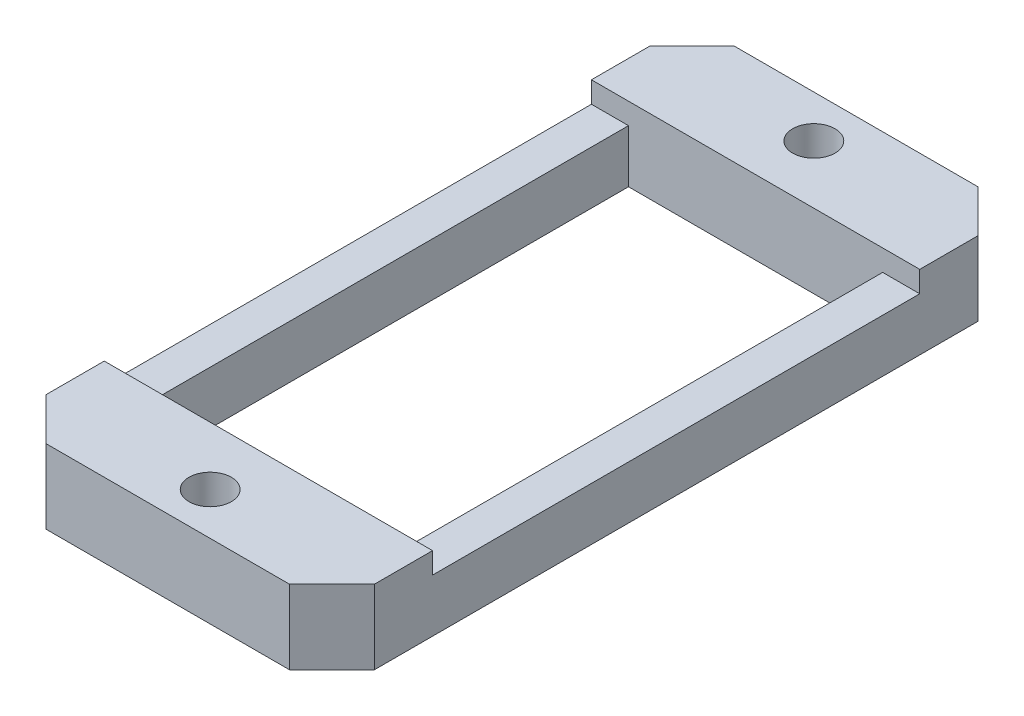
from build123d import *

# Parameters (mm, degrees)
EXTRUDE_1_DEPTH     = 7.75
SKETCH_3_R          = 1
SKETCH_3_W          = 12
SKETCH_3_H          = 23
CUT_EXTRUDE_1_DEPTH = 34.594084301
CHAMFER_1_SIZE      = 2


with BuildPart() as part:
    # 草圖2 → 填料-伸長1 (new, symmetric)
    with BuildSketch(Plane(origin=(0, 0, 0), x_dir=(0, 0, -1), z_dir=(1, 0, 0))):
        Polygon((27.75, 3.5), (32.5, 3.5), (32.5, 0), (0, 0), (0, 3.5), (4.75, 3.5), (4.75, 2.5), (27.75, 2.5), align=None)
    extrude(amount=EXTRUDE_1_DEPTH, both=True)

    # 草圖3 → 除料-伸長1 (cut, through all)
    with BuildSketch(Plane.XZ):
        with Locations(Location((0, -2, 0), (0, 0, 270))):
            Circle(SKETCH_3_R)
        with Locations(Location((0, -30.5, 0), (0, 0, 270))):
            Circle(SKETCH_3_R)
        with Locations((0, -16.25)):
            Rectangle(SKETCH_3_W, SKETCH_3_H)
    extrude(amount=-CUT_EXTRUDE_1_DEPTH, mode=Mode.SUBTRACT)

    # 導角1
    chamfer_1_edges = [part.edges().sort_by_distance(p)[0] for p in [
        (7.75, 1.75, -32.5),
        (-7.75, 1.75, 0),
        (7.75, 1.75, 0),
        (-7.75, 1.75, -32.5),
    ]]
    chamfer(chamfer_1_edges, length=CHAMFER_1_SIZE)


solid = part.part
